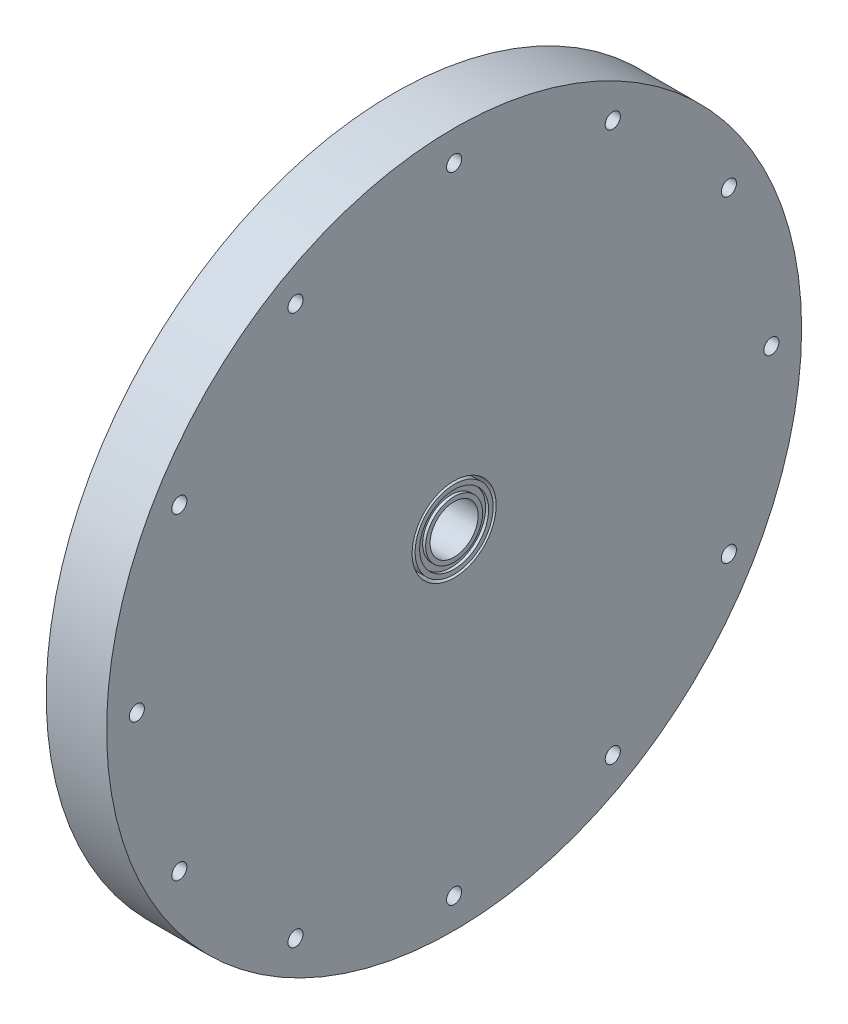
from build123d import *

# Parameters (mm, degrees)
SKETCH1_R               = 146.05
BOSS_EXTRUDE1_DEPTH     = 25.4
SKETCH2_R               = 18.93824
BOSS_EXTRUDE2_DEPTH     = 50.8
SKETCH4_R               = 3.175
CUT_EXTRUDE1_DEPTH      = 25.4
SKETCH5_R               = 18.93824
CUT_EXTRUDE2_DEPTH      = 6.35
CUT_EXTRUDE4_DEPTH      = 50.8
CUT_EXTRUDE4_DEPTH_BACK = 33.02
SKETCH6_R               = 17.66824
SKETCH6_R_2             = 16.39824
SKETCH7_R               = 10.1102497
CUT_EXTRUDE5_DEPTH      = 83.82
SKETCH8_R               = 1.07870498
CUT_EXTRUDE6_DEPTH      = 25.4
CIRPATTERN1_COUNT       = 9
BOSS_EXTRUDE3_START     = 6.35
SKETCH9_R               = 16.39824
SKETCH9_R_2             = 10.1102497
BOSS_EXTRUDE3_DEPTH     = 6.35
BOSS_EXTRUDE4_START     = 6.35
SKETCH10_R              = 18.93824
SKETCH10_R_2            = 17.66824
BOSS_EXTRUDE4_DEPTH     = 6.35
SKETCH11_R              = 14.49324
SKETCH11_R_2            = 11.95324
CUT_EXTRUDE7_DEPTH      = 1.27


with BuildPart() as part:
    # Sketch1 → Boss-Extrude1 (new body)
    with BuildSketch(Plane(origin=(0, 0, 0), x_dir=(0, 0, -1), z_dir=(1, 0, 0))):
        Circle(SKETCH1_R)
    extrude(amount=BOSS_EXTRUDE1_DEPTH)

    # Sketch2 → Boss-Extrude2 (add)
    with BuildSketch(Plane.ZY):
        with Locations(Location((0, 0, 0), (0, 0, 180))):
            Circle(SKETCH2_R)
    extrude(amount=BOSS_EXTRUDE2_DEPTH)

    # Sketch3 → Revolve1 (revolve)
    with BuildSketch(Plane.ZY.offset(50.8)):
        with BuildLine():
            Line((-18.93824, 0), (18.93824, 0))
            ThreePointArc((18.93824, 0), (0, 18.93824), (-18.93824, 0))
        make_face()
    revolve(axis=Axis((-50.8, 0, -18.93824), (0, 0, 1)))

    # Sketch4 → Cut-Extrude1 (cut)
    with BuildSketch(Plane(origin=(25.4, 0, 0), x_dir=(0, 0, -1), z_dir=(1, 0, 0))):
        with Locations((0, -133.35)):
            Circle(SKETCH4_R)
        with Locations((-66.675, -115.484487595)):
            Circle(SKETCH4_R)
        with Locations((-115.484487595, -66.675)):
            Circle(SKETCH4_R)
        with Locations((-133.35, 0)):
            Circle(SKETCH4_R)
        with Locations((-115.484487595, 66.675)):
            Circle(SKETCH4_R)
        with Locations((-66.675, 115.484487595)):
            Circle(SKETCH4_R)
        with Locations((0, 133.35)):
            Circle(SKETCH4_R)
        with Locations((66.675, 115.484487595)):
            Circle(SKETCH4_R)
        with Locations((115.484487595, 66.675)):
            Circle(SKETCH4_R)
        with Locations((133.35, 0)):
            Circle(SKETCH4_R)
        with Locations((115.484487595, -66.675)):
            Circle(SKETCH4_R)
        with Locations((66.675, -115.484487595)):
            Circle(SKETCH4_R)
    extrude(amount=-CUT_EXTRUDE1_DEPTH, mode=Mode.SUBTRACT)

    # Sketch5 → Cut-Extrude2 (cut)
    with BuildSketch(Plane(origin=(25.4, 0, 0), x_dir=(0, 0, -1), z_dir=(1, 0, 0))):
        Circle(SKETCH5_R)
    extrude(amount=-CUT_EXTRUDE2_DEPTH, mode=Mode.SUBTRACT)

    # Sketch6 → Cut-Extrude4 (cut, two sides: drawn at the far end of the back side and taken through both)
    with BuildSketch(Plane.ZY.offset(-CUT_EXTRUDE4_DEPTH_BACK)):
        Circle(SKETCH6_R)
        Circle(SKETCH6_R_2, mode=Mode.SUBTRACT)
    extrude(amount=CUT_EXTRUDE4_DEPTH + CUT_EXTRUDE4_DEPTH_BACK, mode=Mode.SUBTRACT)

    # Sketch7 → Cut-Extrude5 (cut)
    with BuildSketch(Plane(origin=(19.05, 0, 0), x_dir=(0, 0, -1), z_dir=(1, 0, 0))):
        Circle(SKETCH7_R)
    extrude(amount=-CUT_EXTRUDE5_DEPTH, mode=Mode.SUBTRACT)

    # Sketch8 → Cut-Extrude6 (cut)
    with BuildSketch(Plane.XY):
        with Locations((-57.278347741, 3.675298851)):
            Circle(SKETCH8_R)
    cut_extrude6 = extrude(amount=-CUT_EXTRUDE6_DEPTH, mode=Mode.SUBTRACT)

    # CirPattern1: Cut-Extrude6 ×9 about axis
    cirpattern1_axis = Axis((-50.8, 0, 0), (-1, 0, 0))
    for i in range(1, CIRPATTERN1_COUNT):
        add(cut_extrude6.rotate(cirpattern1_axis, i * 360 / CIRPATTERN1_COUNT), mode=Mode.SUBTRACT)

    # Sketch9 → Boss-Extrude3 (add)
    with BuildSketch(Plane(origin=(19.05, 0, 0), x_dir=(0, 0, -1), z_dir=(1, 0, 0)).offset(BOSS_EXTRUDE3_START)):
        with Locations(Location((0, 0, 0), (0, 0, 180))):
            Circle(SKETCH9_R)
        Circle(SKETCH9_R_2, mode=Mode.SUBTRACT)
    extrude(amount=-BOSS_EXTRUDE3_DEPTH)

    # Sketch10 → Boss-Extrude4 (add)
    with BuildSketch(Plane(origin=(19.05, 0, 0), x_dir=(0, 0, -1), z_dir=(1, 0, 0)).offset(BOSS_EXTRUDE4_START)):
        Circle(SKETCH10_R)
        with Locations(Location((0, 0, 0), (0, 0, 180))):
            Circle(SKETCH10_R_2, mode=Mode.SUBTRACT)
    extrude(amount=-BOSS_EXTRUDE4_DEPTH)

    # Sketch11 → Cut-Extrude7 (cut)
    with BuildSketch(Plane(origin=(25.4, 0, 0), x_dir=(0, 0, -1), z_dir=(1, 0, 0))):
        Circle(SKETCH11_R)
        Circle(SKETCH11_R_2, mode=Mode.SUBTRACT)
    extrude(amount=-CUT_EXTRUDE7_DEPTH, mode=Mode.SUBTRACT)


solid = part.part
